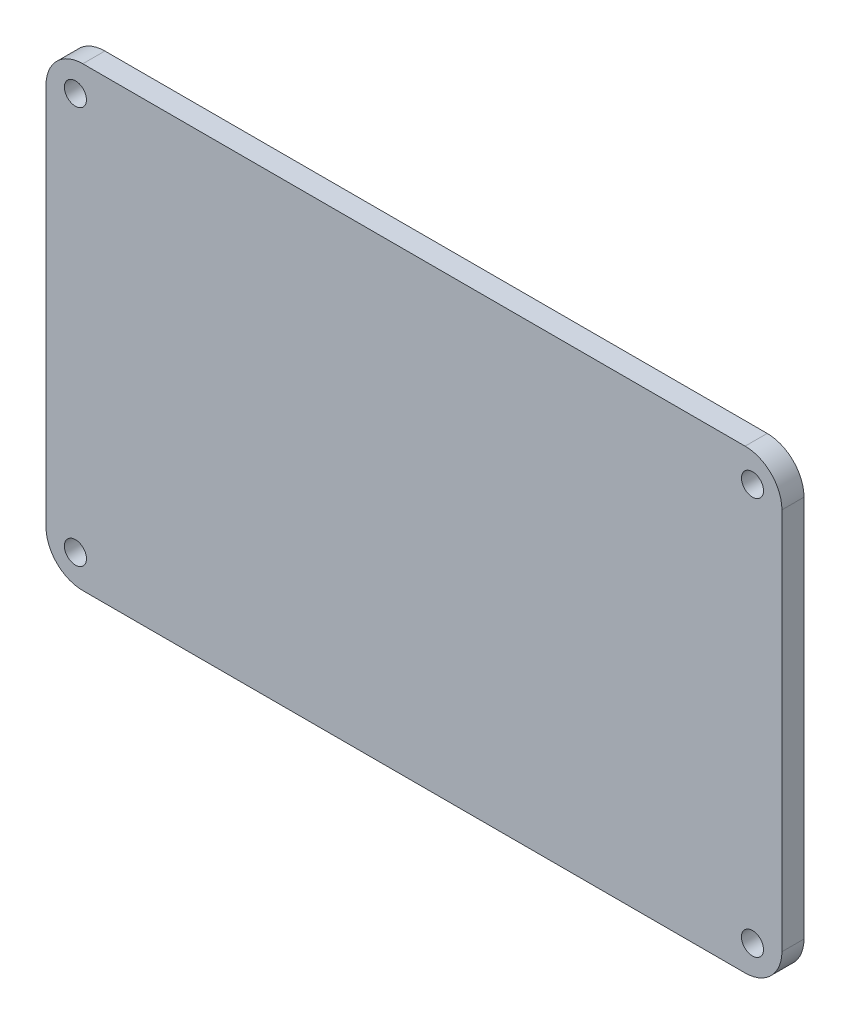
from build123d import *

# Parameters (mm, degrees)
EXTRUDE_1_DEPTH     = 3
SKETCH_2_R          = 1.5
CUT_EXTRUDE_1_DEPTH = 3


with BuildPart() as part:
    # 草图1 → 凸台-拉伸1 (new body)
    with BuildSketch(Plane.XY):
        with BuildLine():
            Line((-45, 31), (45, 31))
            ThreePointArc((45, 31), (48.535533906, 29.535533906), (50, 26))
            Line((50, 26), (50, -26))
            ThreePointArc((50, -26), (48.535533906, -29.535533906), (45, -31))
            Line((45, -31), (-45, -31))
            ThreePointArc((-45, -31), (-48.535533906, -29.535533906), (-50, -26))
            Line((-50, -26), (-50, 26))
            ThreePointArc((-50, 26), (-48.535533906, 29.535533906), (-45, 31))
        make_face()
    extrude(amount=EXTRUDE_1_DEPTH)

    # 草图2 → 切除-拉伸1 (cut)
    with BuildSketch(Plane.XY.offset(3)):
        with Locations((-46, 27)):
            Circle(SKETCH_2_R)
        with Locations((46, 27)):
            Circle(SKETCH_2_R)
        with Locations((-46, -27)):
            Circle(SKETCH_2_R)
        with Locations((46, -27)):
            Circle(SKETCH_2_R)
    extrude(amount=-CUT_EXTRUDE_1_DEPTH, mode=Mode.SUBTRACT)


solid = part.part
